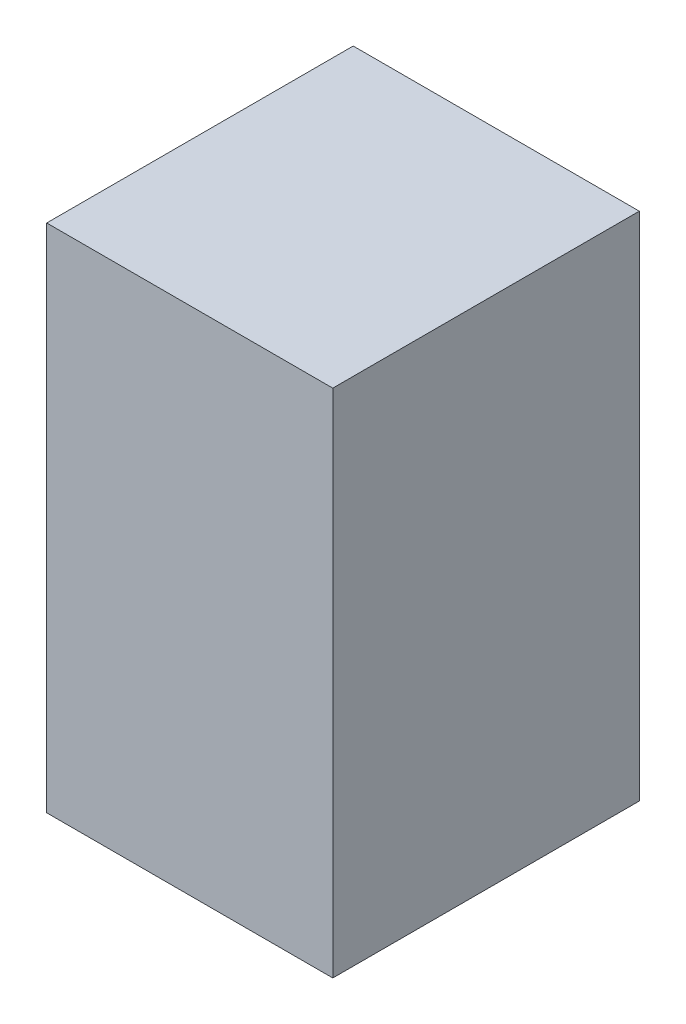
from build123d import *

# Parameters (mm, degrees)
DET2_GERGI_MAKARASI_BRAKETI_1_START = -55
SKETCH1_W                           = 14
SKETCH1_H                           = 25
DET2_GERGI_MAKARASI_BRAKETI_1_DEPTH = 15


with BuildPart() as part:
    # Sketch1 → DET2_gergi_makarasi_braketi_1 (new body)
    with BuildSketch(Plane.XY.offset(DET2_GERGI_MAKARASI_BRAKETI_1_START)):
        with Locations((721, 1552.5)):
            Rectangle(SKETCH1_W, SKETCH1_H)
    extrude(amount=-DET2_GERGI_MAKARASI_BRAKETI_1_DEPTH)


solid = part.part
